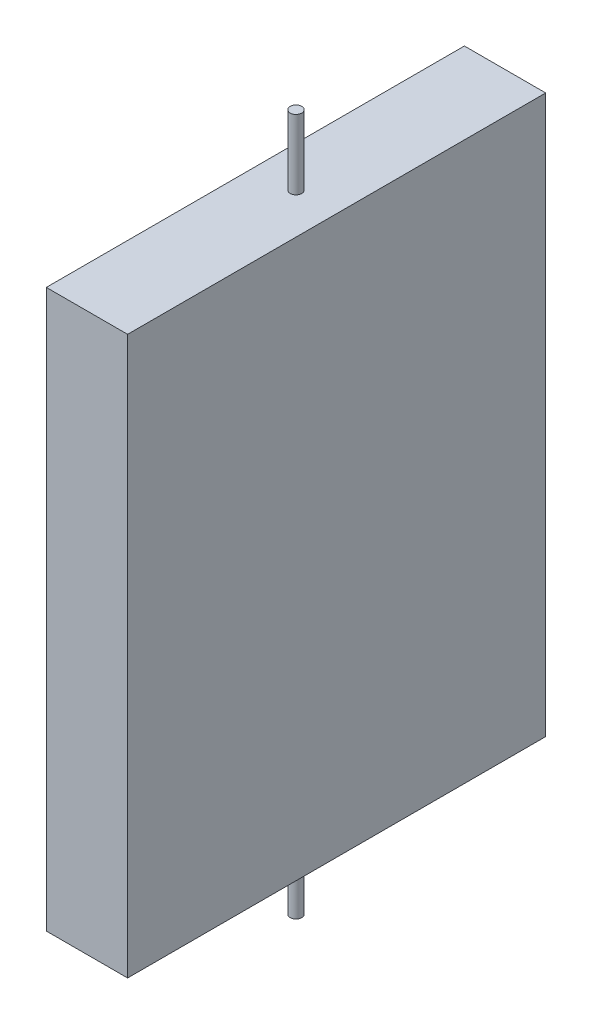
from build123d import *

# Parameters (mm, degrees)
BOSS_EXTRUDE1_DEPTH      = 175
BOSS_EXTRUDE1_DEPTH_BACK = 175
SKETCH1_W                = 2400
SKETCH1_H                = 1800
BOSS_EXTRUDE2_DEPTH      = 1500
BOSS_EXTRUDE2_DEPTH_BACK = 1500
SKETCH2_R                = 25


with BuildPart() as part:
    # Sketch1 → Boss-Extrude1 (new, two sides: drawn at the far end of the back side and taken through both)
    with BuildSketch(Plane.YZ.offset(-BOSS_EXTRUDE1_DEPTH_BACK)):
        Rectangle(SKETCH1_W, SKETCH1_H)
    extrude(amount=BOSS_EXTRUDE1_DEPTH + BOSS_EXTRUDE1_DEPTH_BACK)

    # Sketch2 → Boss-Extrude2 (add, two sides: drawn at the far end of the back side and taken through both)
    with BuildSketch(Plane(origin=(0, 0, 0), x_dir=(1, 0, 0), z_dir=(0, 1, 0)).offset(-BOSS_EXTRUDE2_DEPTH_BACK)):
        Circle(SKETCH2_R)
    extrude(amount=BOSS_EXTRUDE2_DEPTH + BOSS_EXTRUDE2_DEPTH_BACK)


solid = part.part
